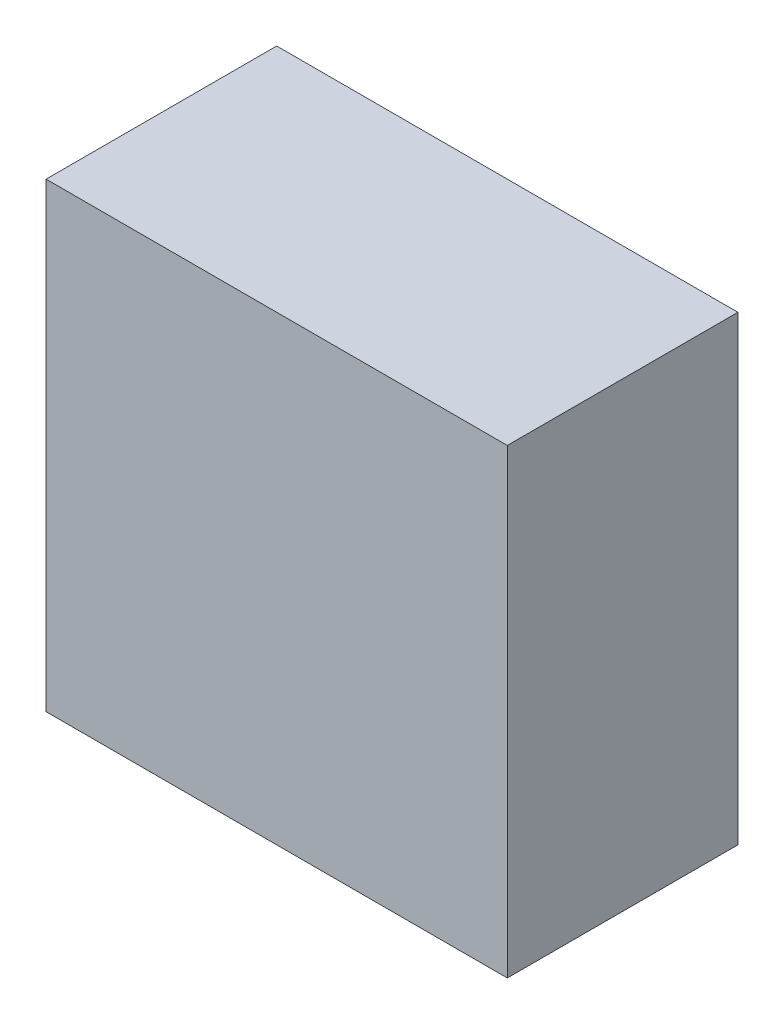
from build123d import *

# Parameters (mm, degrees)
ESQUISSE1_W      = 10
ESQUISSE1_H      = 10
EXTRUSION1_DEPTH = 5


with BuildPart() as part:
    # Esquisse1 → Extrusion1 (new body)
    with BuildSketch(Plane.XY):
        Rectangle(ESQUISSE1_W, ESQUISSE1_H)
    extrude(amount=EXTRUSION1_DEPTH)


solid = part.part
